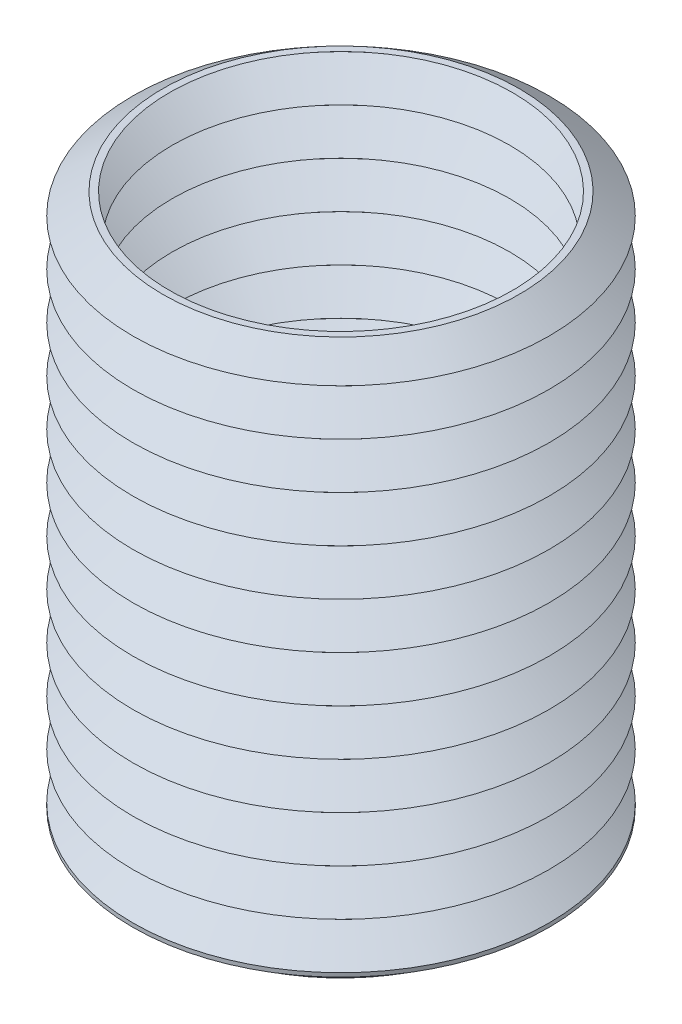
from build123d import *
from build123d.topology import SkipClean

# Parameters (mm, degrees)
SKETCH1_R               = 1.016
SKETCH1_R_2             = 1.5875
SKETCH1_W               = 30.226
SKETCH1_H               = 1.016
BOSS_EXTRUDE1_DEPTH     = 1.778
CUT_EXTRUDE1_DEPTH      = 220.775953397
CUT_EXTRUDE1_DEPTH_BACK = 220.775953397
CUT_EXTRUDE2_DEPTH      = 2.54
CUT_EXTRUDE2_DEPTH_BACK = 2.54
SKETCH10_R              = 0.762
SKETCH13_R              = 43.703973106
CUT_EXTRUDE4_DEPTH      = 126


with BuildPart() as part:
    # Sketch1 → Boss-Extrude1 (new body)
    with BuildSketch(Plane(origin=(0, 0, 0), x_dir=(1, 0, 0), z_dir=(0, 1, 0))):
        with BuildLine():
            Line((19.797340731, -27.686), (33.875449694, -3.302))
            ThreePointArc((33.875449694, -3.302), (33.875449694, 19.558), (14.078108964, 30.988))
            Line((14.078108964, 30.988), (-14.078108964, 30.988))
            ThreePointArc((-14.078108964, 30.988), (-33.875449694, 19.558), (-33.875449694, -3.302))
            Line((-33.875449694, -3.302), (-19.797340731, -27.686))
            ThreePointArc((-19.797340731, -27.686), (0, -39.116), (19.797340731, -27.686))
        make_face()
        with Locations((0, 10.668)):
            Circle(SKETCH1_R, mode=Mode.SUBTRACT)
        with Locations((9.238759008, -5.334)):
            Circle(SKETCH1_R, mode=Mode.SUBTRACT)
        with Locations((-9.238759008, -5.334)):
            Circle(SKETCH1_R, mode=Mode.SUBTRACT)
        Circle(SKETCH1_R_2, mode=Mode.SUBTRACT)
        with Locations((0, 27.94)):
            Rectangle(SKETCH1_W, SKETCH1_H, mode=Mode.SUBTRACT)
        Polygon((32.193190687, -1.135758073), (31.313308877, -0.627758073), (16.200308877, -26.804241927), (17.080190687, -27.312241927), align=None, mode=Mode.SUBTRACT)
        Polygon((-17.080190687, -27.312241927), (-16.200308877, -26.804241927), (-31.313308877, -0.627758073), (-32.193190687, -1.135758073), align=None, mode=Mode.SUBTRACT)
    extrude(amount=BOSS_EXTRUDE1_DEPTH)

    # Sweep1: sweep along a path in Sketch3
    with BuildLine(Plane(origin=(0, 1.778, 0), x_dir=(1, 0, 0), z_dir=(0, 1, 0))) as sweep1_path:
        CenterArc((0, -11.938), 39.878, 0, 360)
    # Sketch4 → Sweep1 (sweep)
    with BuildSketch(Plane(origin=(0, 0, 0), x_dir=(0, 0, -1), z_dir=(1, 0, 0))):
        Polygon((28.598946584, 0), (28.598946584, 2.534258856), (22.248946584, 7.034258856), (28.598946584, 11.534258856), (22.248946584, 16.034258856), (28.598946584, 20.534258856), (22.248946584, 25.034258856), (28.598946584, 29.534258856), (22.248946584, 34.034258856), (28.598946584, 38.534258856), (22.248946584, 43.034258856), (28.598946584, 47.534258856), (22.248946584, 52.034258856), (28.598946584, 56.534258856), (22.248946584, 61.034258856), (28.598946584, 65.534258856), (22.248946584, 70.034258856), (28.598946584, 74.534258856), (22.248946584, 79.034258856), (28.598946584, 83.534258856), (22.248946584, 88.034258856), (28.598946584, 92.534258856), (22.248946584, 97.034258856), (28.598946584, 101.534258856), (22.248946584, 106.034258856), (28.598946584, 110.534258856), (22.248946584, 115.034258856), (28.598946584, 119.534258856), (22.248946584, 124.034258856), (28.598946584, 128.534258856), (22.248946584, 133.034258856), (28.598946584, 137.534258856), (22.248946584, 142.034258856), (28.598946584, 146.534258856), (22.248946584, 151.034258856), (28.598946584, 155.534258856), (22.248946584, 160.034258856), (28.598946584, 164.534258856), (22.248946584, 169.034258856), (28.598946584, 173.534258856), (22.248946584, 178.034258856), (28.598946584, 182.534258856), (22.248946584, 187.034258856), (28.598946584, 191.534258856), (22.248946584, 196.034258856), (28.598946584, 200.534258856), (22.248946584, 205.034258856), (28.598946584, 209.534258856), (27.281053416, 209.534258856), (20.931053416, 205.034258856), (27.281053416, 200.534258856), (20.931053416, 196.034258856), (27.281053416, 191.534258856), (20.931053416, 187.034258856), (27.281053416, 182.534258856), (20.931053416, 178.034258856), (27.281053416, 173.534258856), (20.931053416, 169.034258856), (27.281053416, 164.534258856), (20.931053416, 160.034258856), (27.281053416, 155.534258856), (20.931053416, 151.034258856), (27.281053416, 146.534258856), (20.931053416, 142.034258856), (27.281053416, 137.534258856), (20.931053416, 133.034258856), (27.281053416, 128.534258856), (20.931053416, 124.034258856), (27.281053416, 119.534258856), (20.931053416, 115.034258856), (27.281053416, 110.534258856), (20.931053416, 106.034258856), (27.281053416, 101.534258856), (20.931053416, 97.034258856), (27.281053416, 92.534258856), (20.931053416, 88.034258856), (27.281053416, 83.534258856), (20.931053416, 79.034258856), (27.281053416, 74.534258856), (20.931053416, 70.034258856), (27.281053416, 65.534258856), (20.931053416, 61.034258856), (27.281053416, 56.534258856), (20.931053416, 52.034258856), (27.281053416, 47.534258856), (20.931053416, 43.034258856), (27.281053416, 38.534258856), (20.931053416, 34.034258856), (27.281053416, 29.534258856), (20.931053416, 25.034258856), (27.281053416, 20.534258856), (20.931053416, 16.034258856), (27.281053416, 11.534258856), (20.931053416, 7.034258856), (27.281053416, 2.534258856), (27.281053416, 0), align=None)
    sweep(path=sweep1_path.line)

    # Sketch5 → Cut-Extrude1 (cut, two sides: drawn at the far end of the back side and taken through both)
    with BuildSketch(Plane(origin=(0, 0, 0), x_dir=(0, 0, -1), z_dir=(1, 0, 0)).offset(-CUT_EXTRUDE1_DEPTH_BACK)):
        Polygon((-3.302, 1.778), (53.644453892, 1.778), (53.644453892, 0), (-109.531045718, -2.438778333), (-109.531045718, 1.778), (-27.686, 1.778), align=None)
    extrude(amount=CUT_EXTRUDE1_DEPTH + CUT_EXTRUDE1_DEPTH_BACK, mode=Mode.SUBTRACT)

    # Sweep2: sweep along a curve in space
    with BuildLine() as sweep2_path:
        ThreePointArc((0, 1.778, -28.598946584), (28.663949818, 1.778, -16.725949818), (40.536946584, 1.778, 11.938))
        ThreePointArc((40.536946584, 1.778, 11.938), (28.663949818, 1.778, 40.601949818), (0, 1.778, 52.474946584))
        ThreePointArc((0, 1.778, 52.474946584), (-28.663949818, 1.778, 40.601949818), (-40.536946584, 1.778, 11.938))
        ThreePointArc((-40.536946584, 1.778, 11.938), (-28.663949818, 1.778, -16.725949818), (0, 1.778, -28.598946584))
    # Sketch8 → Sweep2 (sweep)
    with BuildSketch(Plane(origin=(0, 0, 0), x_dir=(0, 0, -1), z_dir=(1, 0, 0))):
        Polygon((27.281053416, 1.778), (20.093617346, -3.453908136), (21.411510514, -3.453908136), (28.598946584, 1.778), align=None)
    sweep(path=sweep2_path.line)

    # Sketch12 → Revolve1 (revolve)
    with BuildSketch(Plane(origin=(0, 0, 0), x_dir=(0, 0, -1), z_dir=(1, 0, 0))):
        Polygon((28.598946584, 1.778), (27.281053416, 1.778), (20.093617346, -3.453908136), (21.411510514, -3.453908136), align=None)
        Polygon((20.093617346, 214.766166991), (21.411510514, 214.766166991), (28.598946584, 209.534258856), (27.281053416, 208.600318815), (27.281053416, 209.534258856), align=None)
    revolve(axis=Axis((0, 209.534258856, 11.938), (0, 1, 0)))

    # Sketch10 → Cut-Extrude2 (cut, two sides: drawn at the far end of the back side and taken through both)
    with SkipClean():  # the faces are left unmerged after this step: merging them gives an invalid solid
        with BuildSketch(Plane(origin=(0, -12.445383757, -9.059295122), x_dir=(1, 0, 0), z_dir=(0, 0.8084854971869895, 0.5885161007468755)).offset(-CUT_EXTRUDE2_DEPTH_BACK)):
            with Locations((0, 19.668215175)):
                Circle(SKETCH10_R)
        extrude(amount=CUT_EXTRUDE2_DEPTH + CUT_EXTRUDE2_DEPTH_BACK, mode=Mode.SUBTRACT)

    # Sketch13 → Cut-Extrude4 (cut)
    with SkipClean():  # the faces are left unmerged after this step: merging them gives an invalid solid
        with BuildSketch(Plane(origin=(0, 105.656129428, 0), x_dir=(1, 0, 0), z_dir=(0, 1, 0))):
            with Locations((0, -11.938)):
                Circle(SKETCH13_R)
        extrude(amount=CUT_EXTRUDE4_DEPTH, mode=Mode.SUBTRACT)


solid = part.part
